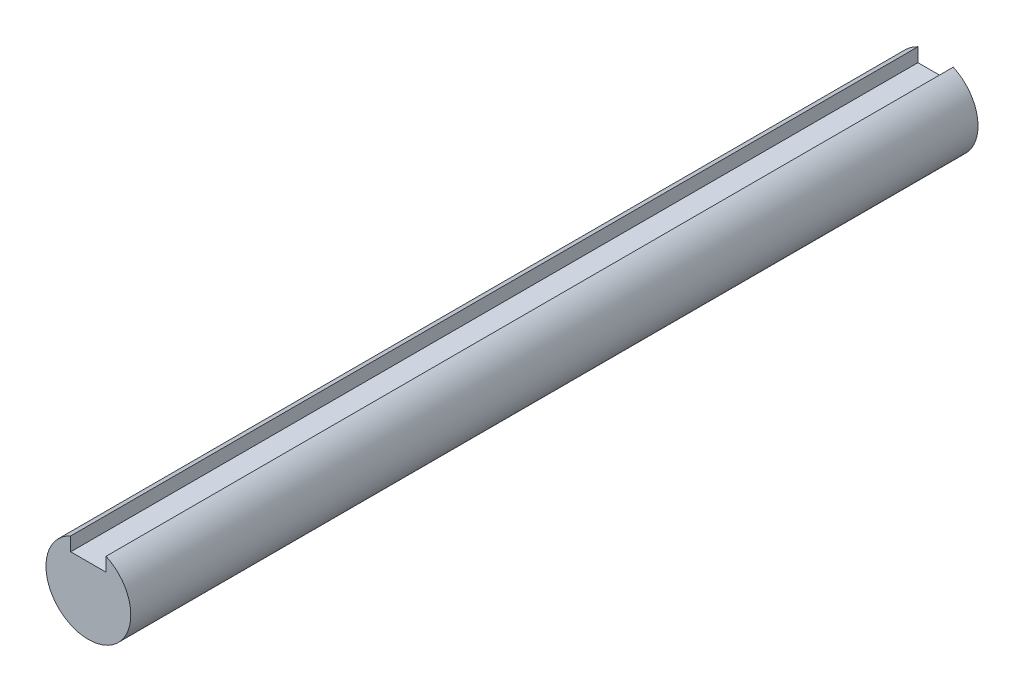
from build123d import *

# Parameters (mm, degrees)
BOSS_EXTRUDE2_DEPTH = 59.944


with BuildPart() as part:
    # Sketch2 → Boss-Extrude2 (new, symmetric)
    with BuildSketch(Plane.XY):
        with BuildLine():
            Line((-2.5, 3.5), (-2.5, 5.454356057))
            ThreePointArc((-2.5, 5.454356057), (-3.240370349, -5.049752469), (6, 0))
            ThreePointArc((6, 0), (5.049752469, 3.240370349), (2.5, 5.454356057))
            Line((2.5, 5.454356057), (2.5, 3.5))
            Line((2.5, 3.5), (-2.5, 3.5))
        make_face()
    extrude(amount=BOSS_EXTRUDE2_DEPTH, both=True)


solid = part.part
